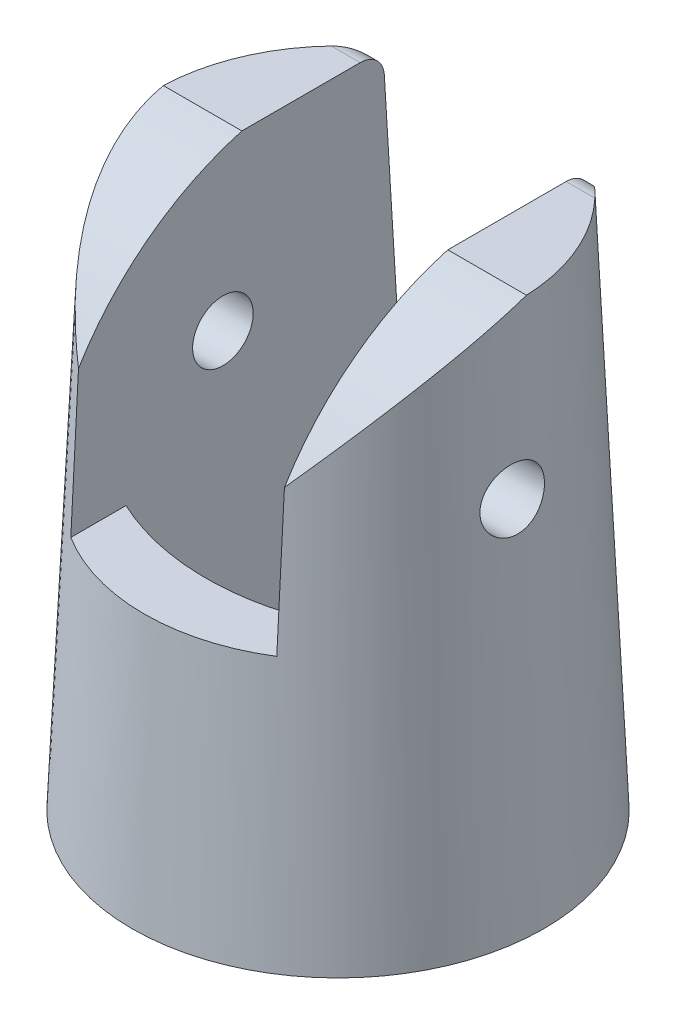
from build123d import *

# Parameters (mm, degrees)
SKETCH2_R               = 7.5
SKETCH3_R               = 8.5
CUT_EXTRUDE1_DEPTH      = 10
CUT_EXTRUDE1_DEPTH_BACK = 10
SKETCH9_W               = 8.5
SKETCH9_H               = 24.609106297
CUT_EXTRUDE2_DEPTH      = 10
CUT_EXTRUDE2_DEPTH_BACK = 10
CUT_EXTRUDE3_DEPTH      = 14
FILLET1_R               = 1
SKETCH12_R              = 1.25
CUT_EXTRUDE4_DEPTH      = 9


with BuildPart() as part:
    # Sketch2 → Loft1 section 0
    with BuildSketch(Plane(origin=(0, 22, 0), x_dir=(1, 0, 0), z_dir=(0, 1, 0))):
        Circle(SKETCH2_R)
    # Sketch3 → Loft1 section 1
    with BuildSketch(Plane(origin=(0, 0, 0), x_dir=(1, 0, 0), z_dir=(0, 1, 0))):
        Circle(SKETCH3_R)
    loft()

    # Sketch9 → Cut-Extrude1 (cut, two sides: drawn at the far end of the back side and taken through both)
    with BuildSketch(Plane.XY.offset(-CUT_EXTRUDE1_DEPTH_BACK)):
        with Locations((0, 23.304553149)):
            Rectangle(SKETCH9_W, SKETCH9_H)
    extrude(amount=CUT_EXTRUDE1_DEPTH + CUT_EXTRUDE1_DEPTH_BACK, mode=Mode.SUBTRACT)

    # Sketch10 → Cut-Extrude2 (cut, two sides: drawn at the far end of the back side and taken through both)
    with BuildSketch(Plane(origin=(0, 0, 0), x_dir=(0, 0, -1), z_dir=(1, 0, 0)).offset(-CUT_EXTRUDE2_DEPTH_BACK)):
        with BuildLine():
            ThreePointArc((1.551397817, 22.278129211), (-3.230375863, 20.336914385), (-6.681717999, 16.5))
            Line((-6.681717999, 16.5), (-6.777720856, 11))
            Line((-6.777720856, 11), (-14.541953313, 11))
            Line((-14.541953313, 11), (-14.541953313, 25.761445422))
            Line((-14.541953313, 25.761445422), (14.965624753, 25.761445422))
            Line((14.965624753, 25.761445422), (14.965624753, 11))
            Line((14.965624753, 11), (6.777720856, 11))
            Line((6.777720856, 11), (6.043769414, 23))
            Line((6.043769414, 23), (1.551397817, 22.278129211))
        make_face()
    extrude(amount=CUT_EXTRUDE2_DEPTH + CUT_EXTRUDE2_DEPTH_BACK, mode=Mode.SUBTRACT)

    # Sketch11 → Cut-Extrude3 (cut)
    with BuildSketch(Plane(origin=(0, 0, 0), x_dir=(-1, 0, 0), z_dir=(0, -1, 0))):
        with BuildLine():
            Line((4.25, -4.5), (4.25, 4.5))
            ThreePointArc((4.25, 4.5), (0, 5.448066505), (-4.25, 4.5))
            Line((-4.25, 4.5), (-4.25, -4.5))
            ThreePointArc((-4.25, -4.5), (0, -5.448066505), (4.25, -4.5))
        make_face()
    extrude(amount=-CUT_EXTRUDE3_DEPTH, mode=Mode.SUBTRACT)

    # Fillet1
    fillet1_edges = [part.edges().sort_by_distance(p)[0] for p in [
        (4.303290893, 22, -6.104932034),
        (-4.303290893, 22, -6.104932034),
    ]]
    fillet(fillet1_edges, radius=FILLET1_R)

    # Sketch12 → Cut-Extrude4 (cut, symmetric)
    with BuildSketch(Plane(origin=(0, 0, 0), x_dir=(0, 0, -1), z_dir=(1, 0, 0))):
        with Locations(Location((-0.5, 15.25, 0), (0, 0, 314.746693022))):
            Circle(SKETCH12_R)
    extrude(amount=CUT_EXTRUDE4_DEPTH, both=True, mode=Mode.SUBTRACT)


solid = part.part
